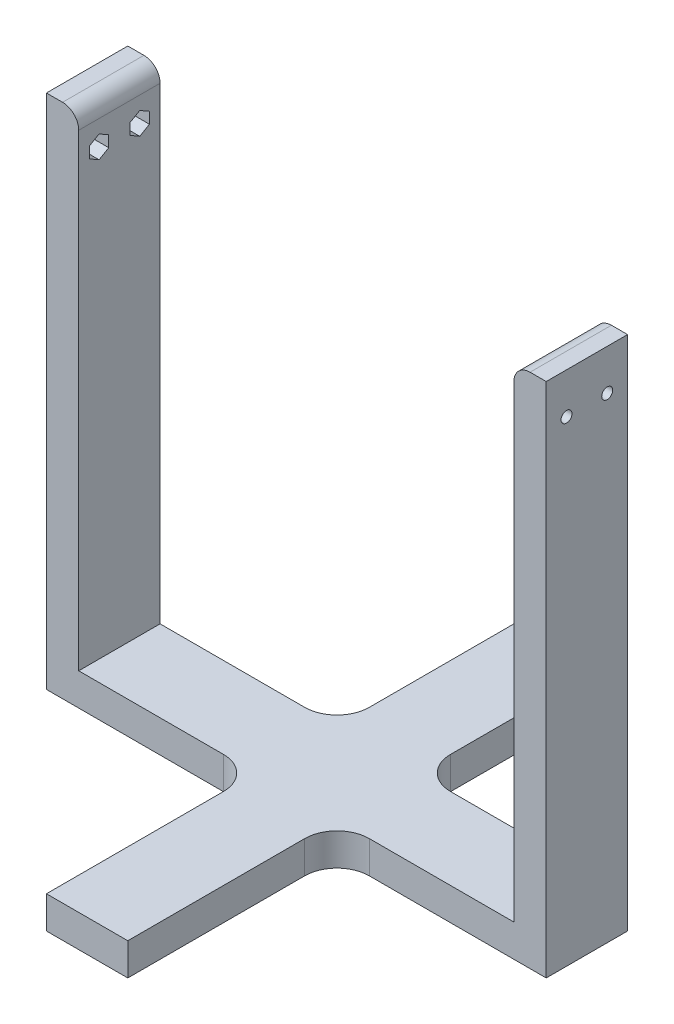
from build123d import *

# Parameters (mm, degrees)
BOSS_EXTRUDE1_DEPTH = 10
SKETCH2_W           = 10
SKETCH2_H           = 25.2
BOSS_EXTRUDE2_DEPTH = 150
SKETCH3_R           = 1.7
CUT_EXTRUDE1_DEPTH  = 236.69853627
CUT_EXTRUDE2_DEPTH  = 5
FILLET1_R           = 10
FILLET2_R           = 5


with BuildPart() as part:
    # Sketch1 → Boss-Extrude1 (new body)
    with BuildSketch(Plane(origin=(0, 0, 0), x_dir=(1, 0, 0), z_dir=(0, 1, 0))):
        Polygon((12.6, 12.6), (77.4, 12.6), (77.4, -12.6), (12.6, -12.6), (12.6, -77.4), (-12.6, -77.4), (-12.6, -12.6), (-77.4, -12.6), (-77.4, 12.6), (-12.6, 12.6), (-12.6, 77.4), (12.6, 77.4), align=None)
    extrude(amount=BOSS_EXTRUDE1_DEPTH)

    # Sketch2 → Boss-Extrude2 (add)
    with BuildSketch(Plane(origin=(0, 10, 0), x_dir=(1, 0, 0), z_dir=(0, 1, 0))):
        with Locations((72.4, 0)):
            Rectangle(SKETCH2_W, SKETCH2_H)
    boss_extrude2 = extrude(amount=BOSS_EXTRUDE2_DEPTH)

    # Sketch3 → Cut-Extrude1 (cut, through all)
    with BuildSketch(Plane(origin=(77.4, 0, 0), x_dir=(0, 0, -1), z_dir=(1, 0, 0))):
        with Locations((-6.3, 147.4)):
            Circle(SKETCH3_R)
        with Locations((6.3, 147.4)):
            Circle(SKETCH3_R)
    cut_extrude1 = extrude(amount=-CUT_EXTRUDE1_DEPTH, mode=Mode.SUBTRACT)

    # Sketch4 → Cut-Extrude2 (cut)
    with BuildSketch(Plane.ZY.offset(-67.4)):
        Polygon((-6.3, 143.935898385), (-3.3, 145.667949192), (-3.3, 149.132050808), (-6.3, 150.864101615), (-9.3, 149.132050808), (-9.3, 145.667949192), align=None)
        Polygon((9.3, 145.667949192), (6.3, 143.935898385), (3.3, 145.667949192), (3.3, 149.132050808), (6.3, 150.864101615), (9.3, 149.132050808), align=None)
    cut_extrude2 = extrude(amount=-CUT_EXTRUDE2_DEPTH, mode=Mode.SUBTRACT)

    # Mirror1: Boss-Extrude2, Cut-Extrude1, Cut-Extrude2 across plane
    add(boss_extrude2.mirror(Plane(origin=(0, 0, 0), x_dir=(0, 0, 1), z_dir=(1, 0, 0))))
    add(cut_extrude1.mirror(Plane(origin=(0, 0, 0), x_dir=(0, 0, 1), z_dir=(1, 0, 0))), mode=Mode.SUBTRACT)
    add(cut_extrude2.mirror(Plane(origin=(0, 0, 0), x_dir=(0, 0, 1), z_dir=(1, 0, 0))), mode=Mode.SUBTRACT)

    # Fillet1
    fillet1_edges = [part.edges().sort_by_distance(p)[0] for p in [
        (12.6, 5, 12.6),
        (-12.6, 5, 12.6),
        (-12.6, 5, -12.6),
        (12.6, 5, -12.6),
    ]]
    fillet(fillet1_edges, radius=FILLET1_R)

    # Fillet2
    fillet2_edges = [part.edges().sort_by_distance(p)[0] for p in [
        (67.4, 160, 0),
        (-67.4, 160, 0),
    ]]
    fillet(fillet2_edges, radius=FILLET2_R)


solid = part.part
